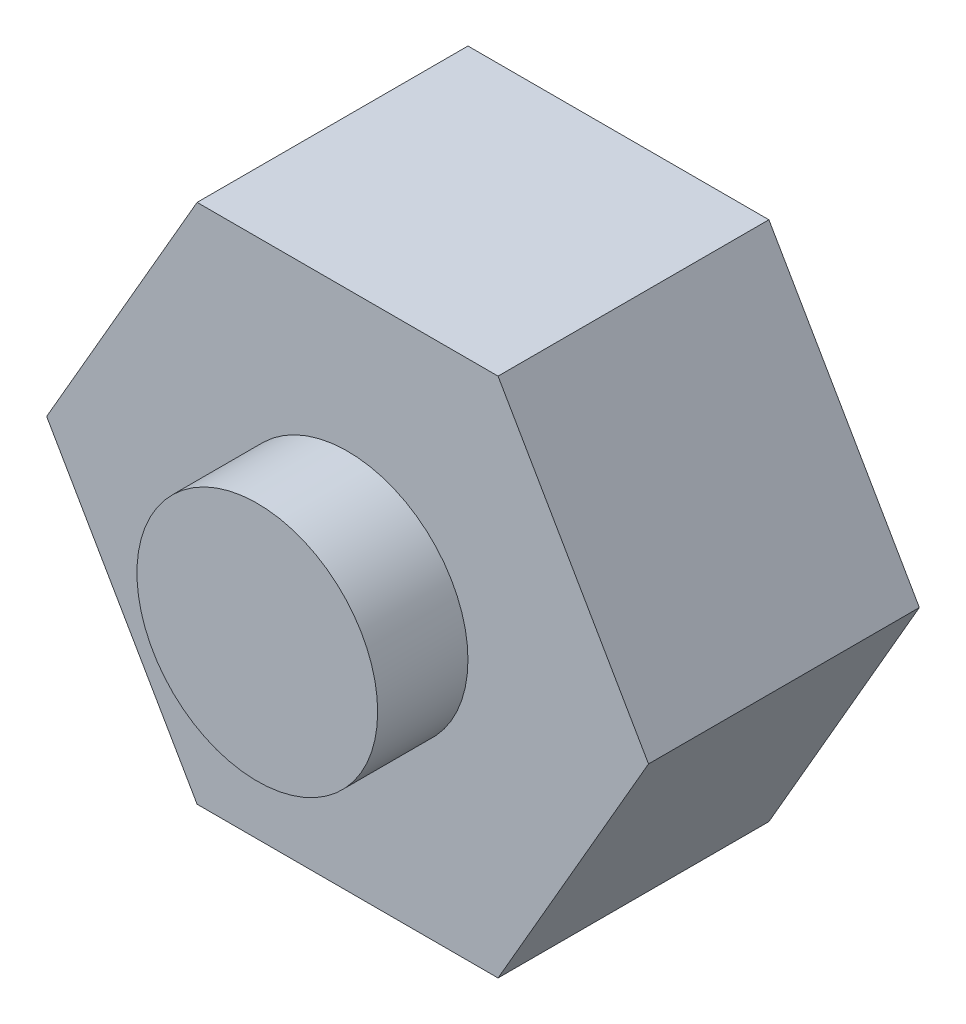
from build123d import *

# Parameters (mm, degrees)
SKETCH_1_R          = 8
EXTRUDE_1_DEPTH     = 24
SKETCH_2_R          = 42
EXTRUDE_2_DEPTH     = 18
SKETCH_3_OUTSIDE_W  = 110.238
SKETCH_3_OUTSIDE_H  = 110.238
CUT_EXTRUDE_1_DEPTH = 63.064482597


with BuildPart() as part:
    # 草图1 → 凸台-拉伸1 (new body)
    with BuildSketch(Plane.XY):
        Circle(SKETCH_1_R)
    extrude(amount=EXTRUDE_1_DEPTH)

    # 草图2 → 凸台-拉伸2 (add)
    with BuildSketch(Plane.XY):
        Circle(SKETCH_2_R)
    extrude(amount=EXTRUDE_2_DEPTH)

    # 草图3 outside → 切除-拉伸1 (cut, through all)
    with BuildSketch(Plane.XY.offset(18)):
        Rectangle(SKETCH_3_OUTSIDE_W, SKETCH_3_OUTSIDE_H)
        Polygon((20, 0), (10, 17.320508076), (-10, 17.320508076), (-20, 0), (-10, -17.320508076), (10, -17.320508076), align=None, mode=Mode.SUBTRACT)
    extrude(amount=-CUT_EXTRUDE_1_DEPTH, mode=Mode.SUBTRACT)


solid = part.part
